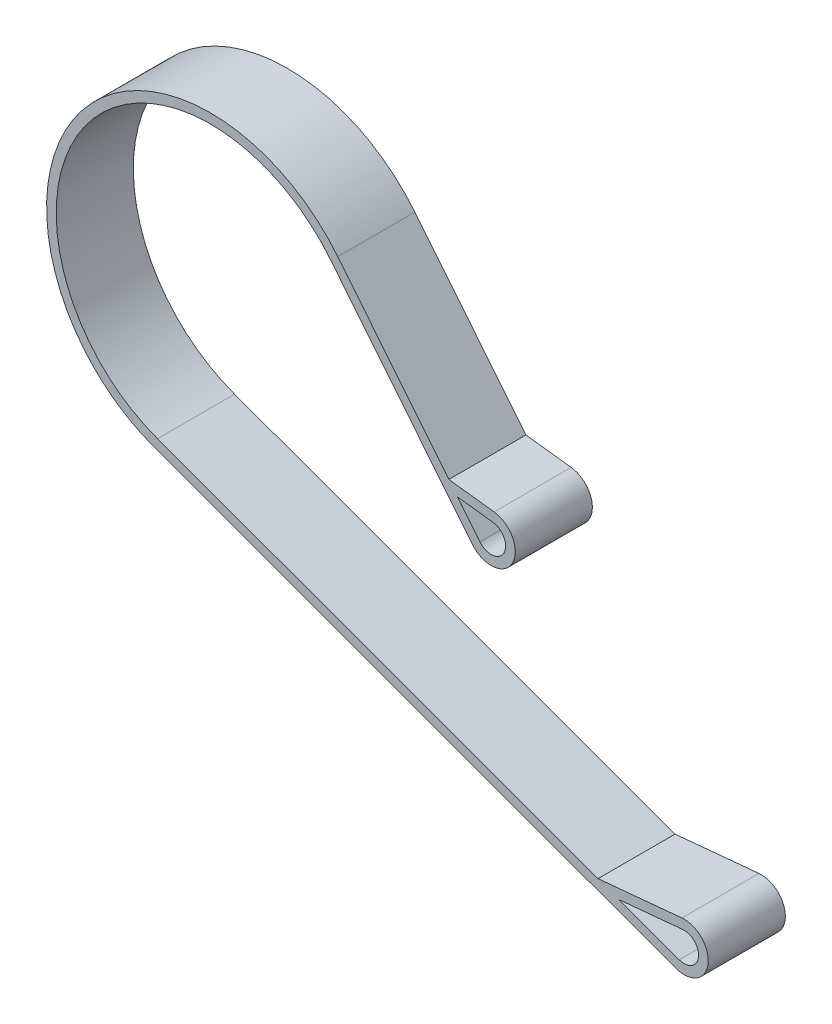
from build123d import *

# Parameters (mm, degrees)
EXTRUDE_THIN1_DEPTH = 25.4
BOSS_EXTRUDE1_REACH = 633.439
SKETCH3_W           = 25.4
SKETCH3_H           = 3.175
BOSS_EXTRUDE2_REACH = 587.221
SKETCH4_W           = 25.4
SKETCH4_H           = 3.175


with BuildPart() as part:
    # Sketch2 → Extrude-Thin1 (new body)
    with BuildSketch(Plane.XY):
        with BuildLine():
            ThreePointArc((-128.959094117, -567.323540773), (-123.788950473, -572.673268248), (-130.145681643, -576.538748578))
            Line((-130.145681643, -576.538748578), (-302.042094367, -513.783924281))
            ThreePointArc((-302.042094367, -513.783924281), (-325.948053636, -436.522751042), (-245.108142892, -434.136832006))
            Line((-245.108142892, -434.136832006), (-198.273248153, -492.098506685))
            ThreePointArc((-198.273248153, -492.098506685), (-185.155706812, -490.955524281), (-191.14596289, -479.229777749))
            Line((-191.14596289, -479.229777749), (-191.527323999, -482.381791186))
            ThreePointArc((-191.527323999, -482.381791186), (-187.933170352, -489.417239105), (-195.803695157, -490.103028547))
            Line((-195.803695157, -490.103028547), (-242.638589895, -432.141353869))
            ThreePointArc((-242.638589895, -432.141353869), (-328.530995061, -434.676392845), (-303.130913338, -516.76638941))
            Line((-303.130913338, -516.76638941), (-131.234500614, -579.521213708))
            ThreePointArc((-131.234500614, -579.521213708), (-120.639948663, -573.078746491), (-129.256854737, -564.162534033))
            Line((-129.256854737, -564.162534033), (-128.959094117, -567.323540773))
        make_face()
    extrude(amount=EXTRUDE_THIN1_DEPTH)

    # Boss-Extrude1: up to this plane
    boss_extrude1_end = Plane(origin=(-242.638589895, -432.141353869, 25.4), z_dir=(-0.7778119673882409, -0.6284970512163396, 0))
    # Sketch3 → Boss-Extrude1 (add, up to the surface)
    with BuildSketch(Plane(origin=(-131.24290391, 15.879037441, 0), x_dir=(0, 0, 1), z_dir=(-0.9927601375164752, 0.12011373509415744, 0)), mode=Mode.PRIVATE) as boss_extrude1_sk1:
        with Locations((12.7, -500.306975611)):
            Rectangle(SKETCH3_W, SKETCH3_H)
    boss_extrude1_tool1 = split(extrude(boss_extrude1_sk1.sketch, amount=BOSS_EXTRUDE1_REACH, mode=Mode.PRIVATE), bisect_by=boss_extrude1_end, keep=Keep.BOTH, mode=Mode.PRIVATE)
    add(boss_extrude1_tool1.solids().sort_by_distance((-191.336643, -480.805784, 12.7))[0])

    # Boss-Extrude2: up to this plane
    boss_extrude2_end = Plane(origin=(-302.042094367, -513.783924281, 25.4), z_dir=(0.3429351088975487, 0.9393590959188219, 0))
    # Sketch4 → Boss-Extrude2 (add, up to the surface)
    with BuildSketch(Plane(origin=(-180.795608077, -17.030590821, 0), x_dir=(0, 0, 1), z_dir=(-0.9955926741540518, -0.09378287248098222, 0)), mode=Mode.PRIVATE) as boss_extrude2_sk1:
        with Locations((12.7, -551.14150679)):
            Rectangle(SKETCH4_W, SKETCH4_H)
    boss_extrude2_tool1 = split(extrude(boss_extrude2_sk1.sketch, amount=BOSS_EXTRUDE2_REACH, mode=Mode.PRIVATE), bisect_by=boss_extrude2_end, keep=Keep.BOTH, mode=Mode.PRIVATE)
    add(boss_extrude2_tool1.solids().sort_by_distance((-129.107974, -565.743037, 12.7))[0])


solid = part.part
